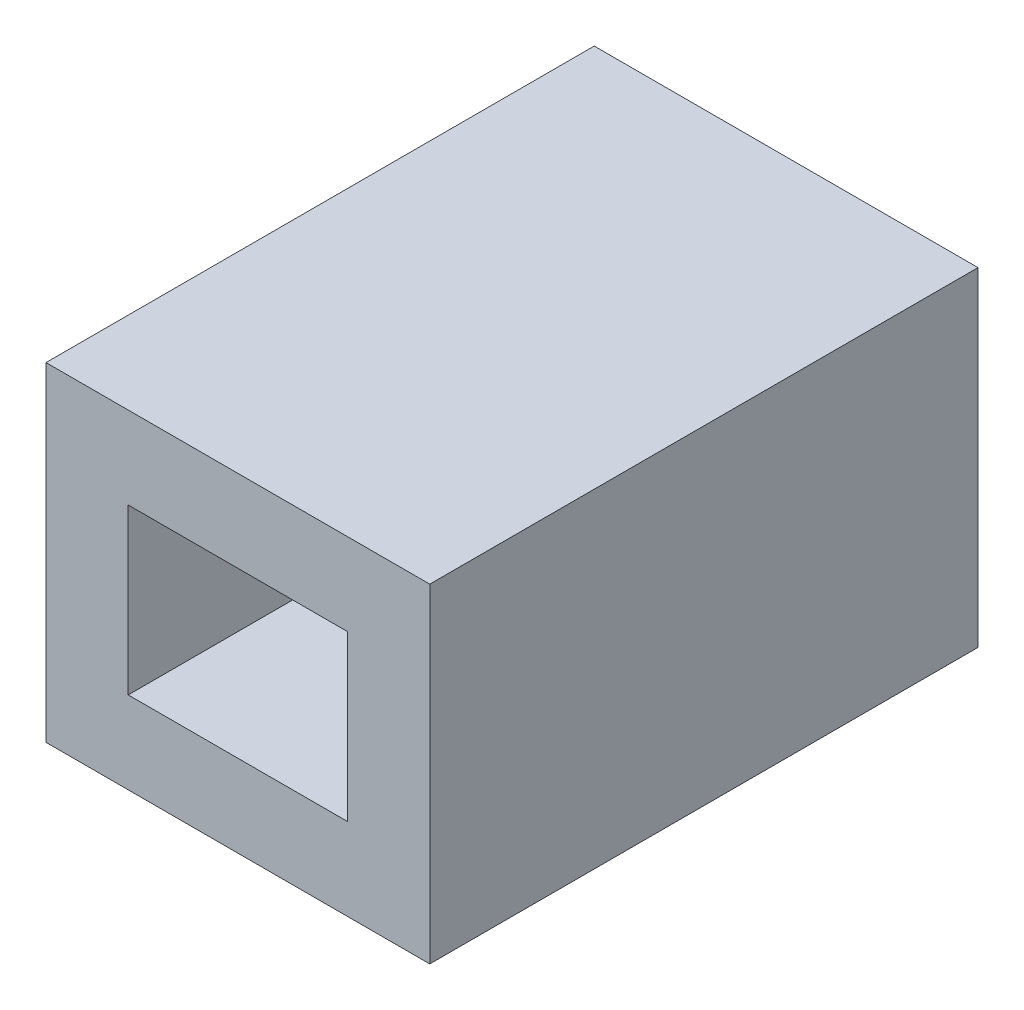
from build123d import *

# Parameters (mm, degrees)
ESQUISSE1_W        = 14
ESQUISSE1_H        = 12
ESQUISSE1_W_2      = 8
ESQUISSE1_H_2      = 6
BOSS_EXTRU_1_DEPTH = 20


with BuildPart() as part:
    # Esquisse1 → Boss.-Extru.1 (new body)
    with BuildSketch(Plane.XY):
        with Locations((7, 6)):
            Rectangle(ESQUISSE1_W, ESQUISSE1_H)
        with Locations((7, 6)):
            Rectangle(ESQUISSE1_W_2, ESQUISSE1_H_2, mode=Mode.SUBTRACT)
    extrude(amount=BOSS_EXTRU_1_DEPTH)


solid = part.part
